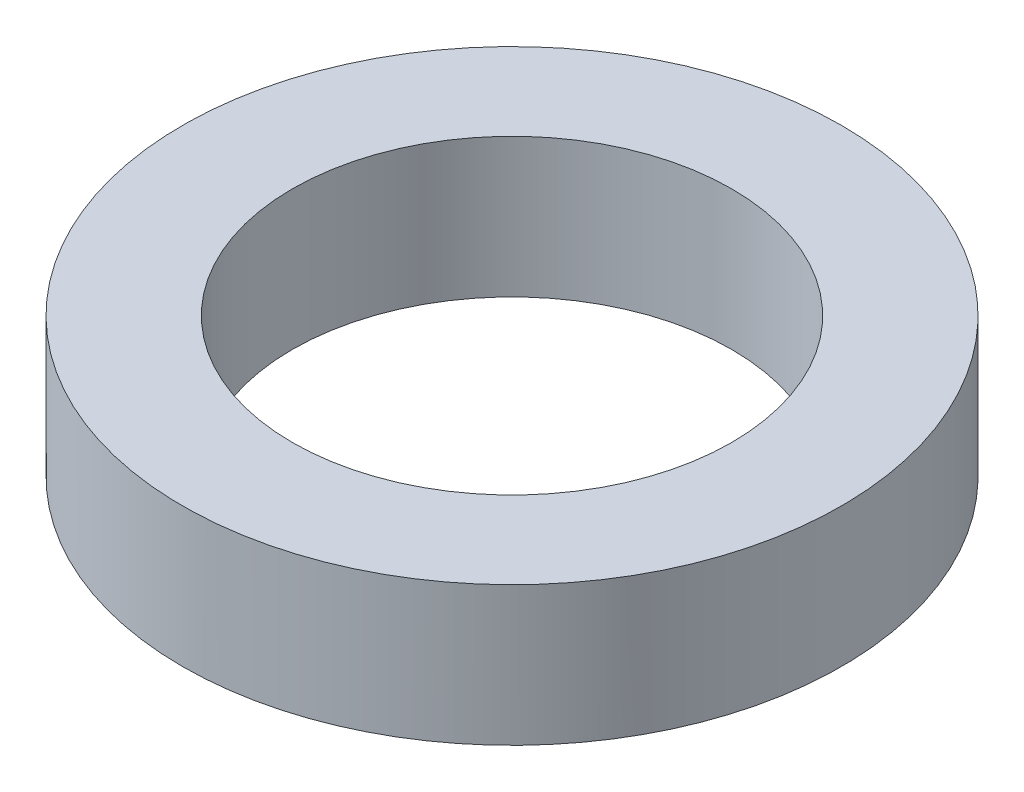
from build123d import *

# Parameters (mm, degrees)
SKETCH1_R           = 11.43
SKETCH1_R_2         = 7.62
BOSS_EXTRUDE1_DEPTH = 4.826


with BuildPart() as part:
    # Sketch1 → Boss-Extrude1 (new body)
    with BuildSketch(Plane(origin=(0, 0, 0), x_dir=(1, 0, 0), z_dir=(0, 1, 0))):
        with Locations(Location((0, 0, 0), (0, 0, 90))):
            Circle(SKETCH1_R)
        with Locations(Location((0, 0, 0), (0, 0, 90))):
            Circle(SKETCH1_R_2, mode=Mode.SUBTRACT)
    extrude(amount=BOSS_EXTRUDE1_DEPTH)


solid = part.part
